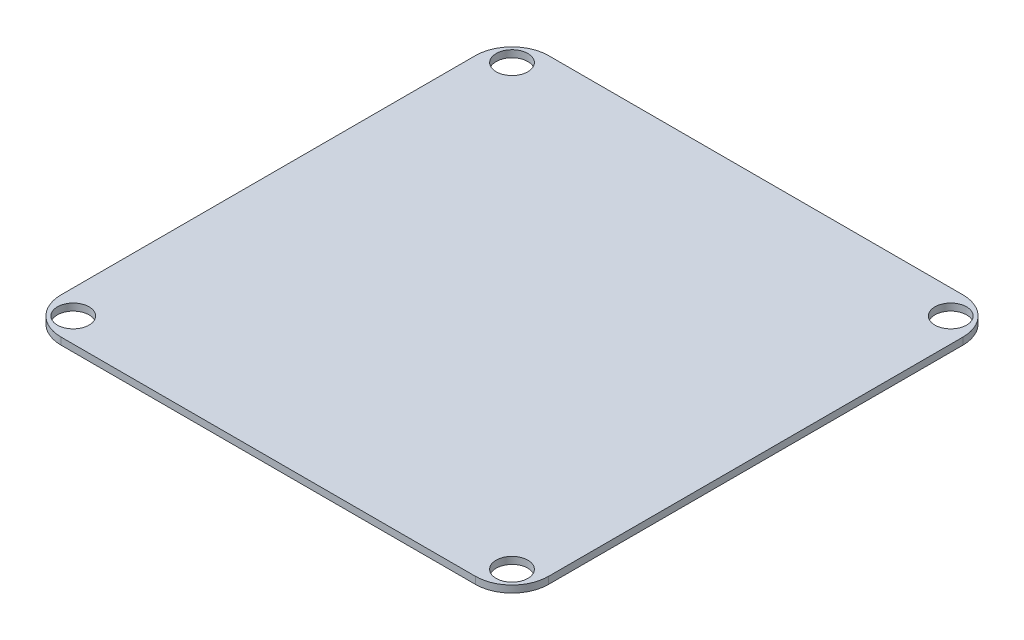
from build123d import *

# Parameters (mm, degrees)
SKETCH1_R           = 1.651
BOSS_EXTRUDE1_DEPTH = 0.73152


with BuildPart() as part:
    # Sketch1 → Boss-Extrude1 (new body)
    with BuildSketch(Plane(origin=(0, 0, 0), x_dir=(1, 0, 0), z_dir=(0, 1, 0))):
        with BuildLine():
            Line((-21.59, 25.4), (21.59, 25.4))
            ThreePointArc((21.59, 25.4), (24.284076836, 24.284076836), (25.4, 21.59))
            Line((25.4, 21.59), (25.4, -21.59))
            ThreePointArc((25.4, -21.59), (24.284076836, -24.284076836), (21.59, -25.4))
            Line((21.59, -25.4), (-21.59, -25.4))
            ThreePointArc((-21.59, -25.4), (-24.284076836, -24.284076836), (-25.4, -21.59))
            Line((-25.4, -21.59), (-25.4, 21.59))
            ThreePointArc((-25.4, 21.59), (-24.284076836, 24.284076836), (-21.59, 25.4))
        make_face()
        with Locations(Location((-22.86, 22.86, 0), (0, 0, 270))):
            Circle(SKETCH1_R, mode=Mode.SUBTRACT)
        with Locations(Location((22.86, 22.86, 0), (0, 0, 270))):
            Circle(SKETCH1_R, mode=Mode.SUBTRACT)
        with Locations(Location((22.86, -22.86, 0), (0, 0, 270))):
            Circle(SKETCH1_R, mode=Mode.SUBTRACT)
        with Locations(Location((-22.86, -22.86, 0), (0, 0, 270))):
            Circle(SKETCH1_R, mode=Mode.SUBTRACT)
    extrude(amount=BOSS_EXTRUDE1_DEPTH)


solid = part.part
